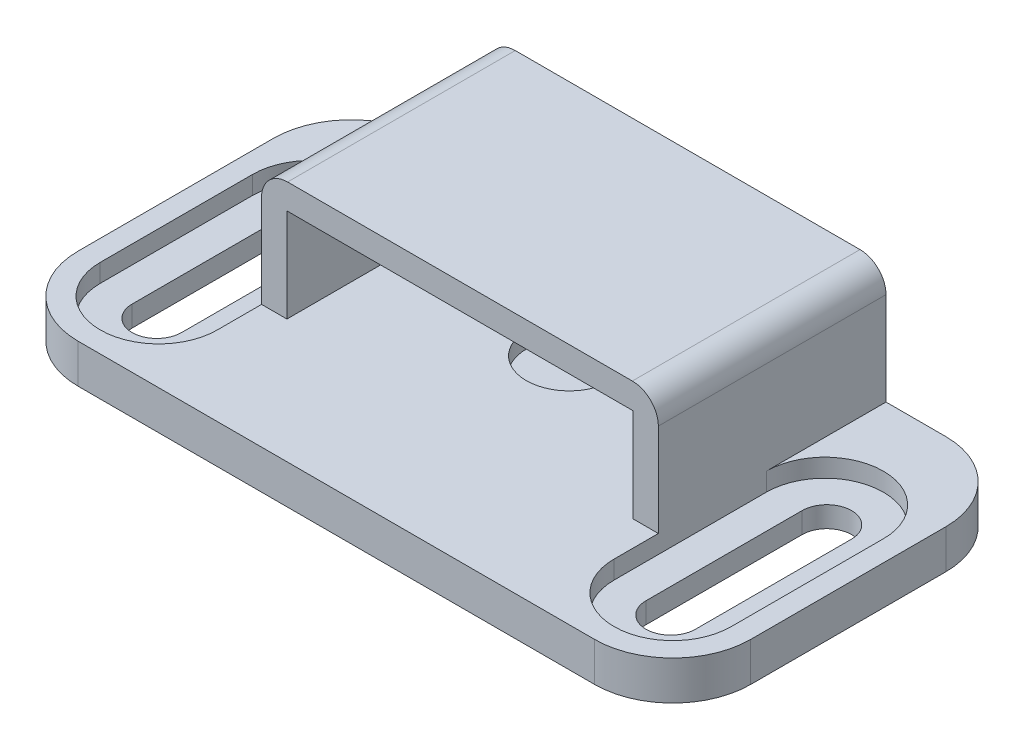
from build123d import *

# Parameters (mm, degrees)
BOSS_EXTRUDE1_DEPTH = 3
CUT_EXTRUDE1_DEPTH  = 1.4
CUT_EXTRUDE2_DEPTH  = 3
BOSS_EXTRUDE2_DEPTH = 17.5
FILLET1_R           = 2
SKETCH8_R           = 3.3
CUT_EXTRUDE3_DEPTH  = 1.2
CUT_EXTRUDE4_START  = -1.2
SKETCH9_R           = 3.3
CUT_EXTRUDE4_DEPTH  = 1.2


with BuildPart() as part:
    # Sketch1 → Boss-Extrude1 (new body)
    with BuildSketch(Plane(origin=(0, 0, 0), x_dir=(1, 0, 0), z_dir=(0, 1, 0))):
        with BuildLine():
            Line((-19.85, -13.5), (19.85, -13.5))
            ThreePointArc((19.85, -13.5), (24.092640687, -11.742640687), (25.85, -7.5))
            Line((25.85, -7.5), (25.85, 7.5))
            ThreePointArc((25.85, 7.5), (24.092640687, 11.742640687), (19.85, 13.5))
            Line((19.85, 13.5), (-19.85, 13.5))
            ThreePointArc((-19.85, 13.5), (-24.092640687, 11.742640687), (-25.85, 7.5))
            Line((-25.85, 7.5), (-25.85, -7.5))
            ThreePointArc((-25.85, -7.5), (-24.092640687, -11.742640687), (-19.85, -13.5))
        make_face()
    extrude(amount=BOSS_EXTRUDE1_DEPTH)

    # Sketch2 → Cut-Extrude1 (cut)
    with BuildSketch(Plane(origin=(0, 3, 0), x_dir=(1, 0, 0), z_dir=(0, 1, 0))):
        with BuildLine():
            Line((-24.25, 4.3), (-24.25, -7.4))
            ThreePointArc((-24.25, -7.4), (-19.75, -11.9), (-15.25, -7.4))
            Line((-15.25, -7.4), (-15.25, 4.3))
            ThreePointArc((-15.25, 4.3), (-19.75, 8.8), (-24.25, 4.3))
        make_face()
        with BuildLine():
            Line((24.25, 4.3), (24.25, -7.4))
            ThreePointArc((24.25, -7.4), (19.75, -11.9), (15.25, -7.4))
            Line((15.25, -7.4), (15.25, 4.3))
            ThreePointArc((15.25, 4.3), (19.75, 8.8), (24.25, 4.3))
        make_face()
    extrude(amount=-CUT_EXTRUDE1_DEPTH, mode=Mode.SUBTRACT)

    # Sketch4 → Cut-Extrude2 (cut)
    with BuildSketch(Plane(origin=(0, 3, 0), x_dir=(1, 0, 0), z_dir=(0, 1, 0))):
        with BuildLine():
            Line((-17.85, 4.45), (-17.85, -7.55))
            ThreePointArc((-17.85, -7.55), (-19.75, -9.45), (-21.65, -7.55))
            Line((-21.65, -7.55), (-21.65, 4.45))
            ThreePointArc((-21.65, 4.45), (-19.75, 6.35), (-17.85, 4.45))
        make_face()
        with BuildLine():
            Line((17.85, 4.45), (17.85, -7.55))
            ThreePointArc((17.85, -7.55), (19.75, -9.45), (21.65, -7.55))
            Line((21.65, -7.55), (21.65, 4.45))
            ThreePointArc((21.65, 4.45), (19.75, 6.35), (17.85, 4.45))
        make_face()
    extrude(amount=-CUT_EXTRUDE2_DEPTH, mode=Mode.SUBTRACT)

    # Sketch5 → Boss-Extrude2 (add)
    with BuildSketch(Plane(origin=(0, 0, -13.5), x_dir=(-1, 0, 0), z_dir=(0, 0, -1))):
        Polygon((-13.3, 3), (-13.3, 10.2), (13.3, 10.2), (13.3, 3), (15.25, 3), (15.25, 12.15), (-15.25, 12.15), (-15.25, 3), align=None)
    extrude(amount=-BOSS_EXTRUDE2_DEPTH)

    # Fillet1
    fillet1_edges = [part.edges().sort_by_distance(p)[0] for p in [
        (15.25, 12.15, -4.75),
        (-15.25, 12.15, -4.75),
    ]]
    fillet(fillet1_edges, radius=FILLET1_R)

    # Sketch8 → Cut-Extrude3 (cut)
    with BuildSketch(Plane(origin=(0, 3, 0), x_dir=(1, 0, 0), z_dir=(0, 1, 0))):
        with Locations(Location((0, 4.4, 0), (0, 0, 270))):
            Circle(SKETCH8_R)
    extrude(amount=-CUT_EXTRUDE3_DEPTH, mode=Mode.SUBTRACT)

    # Sketch9 → Cut-Extrude4 (cut)
    with BuildSketch(Plane.XZ.offset(-10.2).offset(CUT_EXTRUDE4_START)):
        with Locations(Location((0, -4.4, 0), (0, 0, 90))):
            Circle(SKETCH9_R)
    extrude(amount=CUT_EXTRUDE4_DEPTH, mode=Mode.SUBTRACT)

    # Sketch11 → Cut-Loft4 section 0
    with BuildSketch(Plane(origin=(0, 0, -13.5), x_dir=(-1, 0, 0), z_dir=(0, 0, -1))):
        with BuildLine():
            Line((-3.3, 11.8), (3.3, 11.8))
            Line((3.3, 11.8), (3.3, 10.2))
            Line((3.3, 10.2), (-3.3, 10.2))
            Line((-3.3, 10.2), (-3.3, 11.8))
        make_face()
    # Sketch12 → Cut-Loft4 section 1
    with BuildSketch(Plane.XY.offset(-4.4)):
        with BuildLine():
            Line((-3.3, 10.2), (3.3, 10.2))
            Line((3.3, 10.2), (3.3, 10.4))
            Line((3.3, 10.4), (-3.3, 10.4))
            Line((-3.3, 10.4), (-3.3, 10.2))
        make_face()
    loft(mode=Mode.SUBTRACT)

    # Sketch11<110> → Cut-Loft7 section 0
    with BuildSketch(Plane(origin=(0, 0, -13.5), x_dir=(-1, 0, 0), z_dir=(0, 0, -1))):
        with BuildLine():
            Line((-3.3, 3), (3.3, 3))
            Line((3.3, 3), (3.3, 1.4))
            Line((3.3, 1.4), (-3.3, 1.4))
            Line((-3.3, 1.4), (-3.3, 3))
        make_face()
    # Sketch12<5> → Cut-Loft7 section 1
    with BuildSketch(Plane.XY.offset(-4.4)):
        with BuildLine():
            Line((-3.3, 3), (3.3, 3))
            Line((3.3, 3), (3.3, 2.8))
            Line((3.3, 2.8), (-3.3, 2.8))
            Line((-3.3, 2.8), (-3.3, 3))
        make_face()
    loft(mode=Mode.SUBTRACT)


solid = part.part
